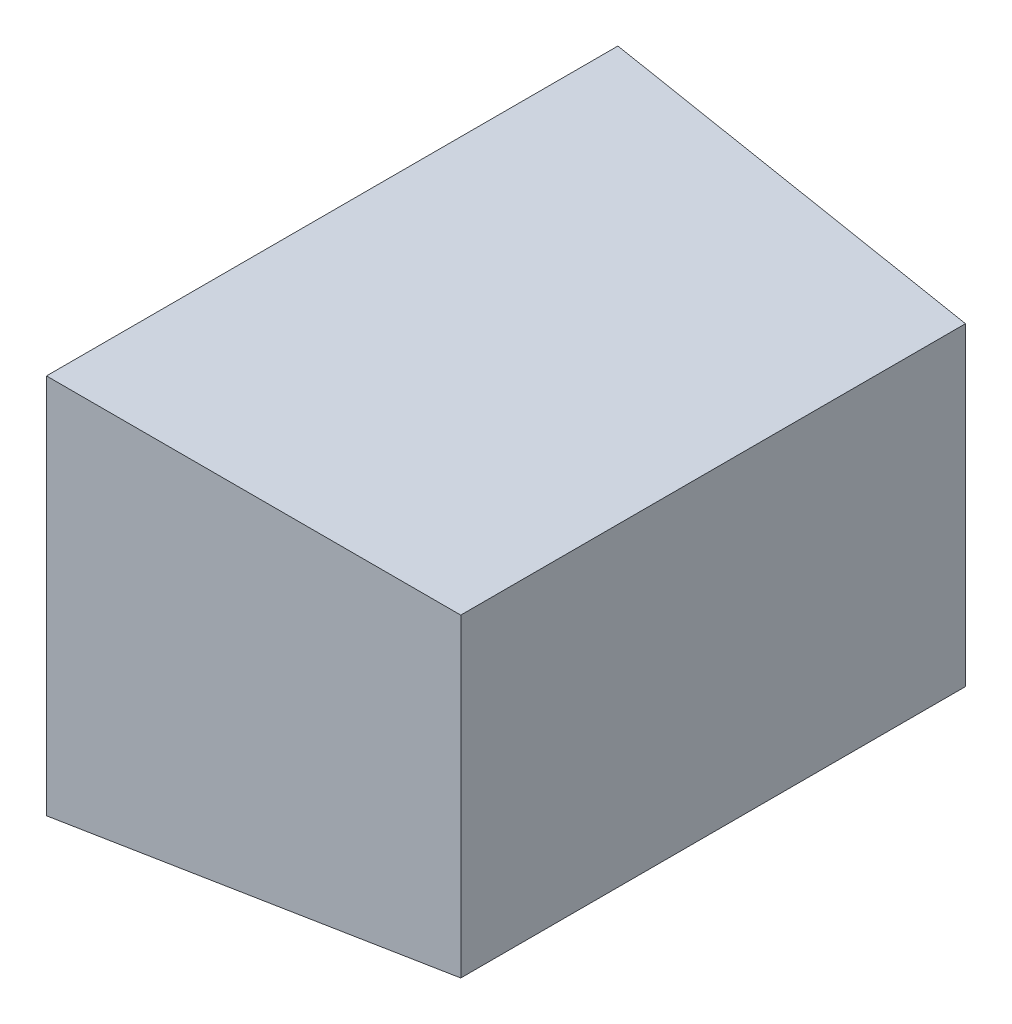
from build123d import *

# Parameters (mm, degrees)
SKETCH2_W           = 150
SKETCH2_H           = 100
BOSS_EXTRUDE1_DEPTH = 100
BOSS_EXTRUDE1_TAPER = 5


with BuildPart() as part:
    # Sketch2 → Boss-Extrude1 (new body)
    with BuildSketch(Plane(origin=(0, 0, 0), x_dir=(0, 0, -1), z_dir=(1, 0, 0))):
        Rectangle(SKETCH2_W, SKETCH2_H)
    extrude(amount=BOSS_EXTRUDE1_DEPTH, taper=BOSS_EXTRUDE1_TAPER)


solid = part.part
